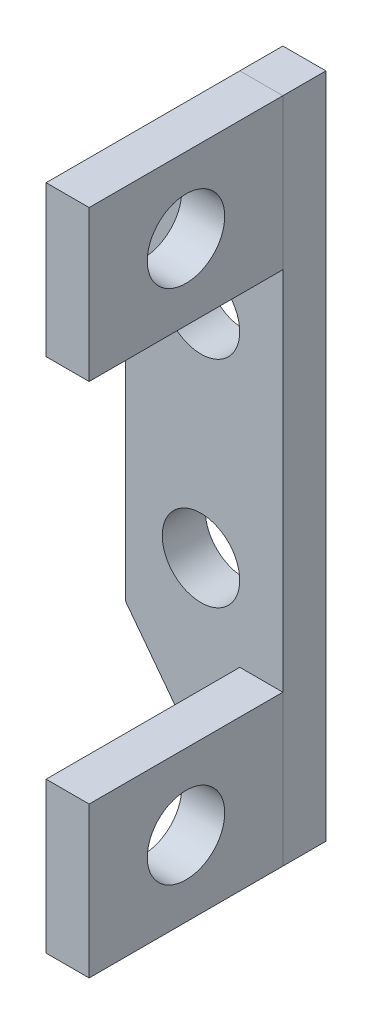
from build123d import *

# Parameters (mm, degrees)
SKETCH2_W                     = 7.304410209
SKETCH2_H                     = 17
BOSS_EXTRUDE1_DEPTH           = 2
M3_CLEARANCE_HOLE1_D          = 3.6
SKETCH6_W                     = 2
SKETCH6_H                     = 7
BOSS_EXTRUDE2_DEPTH           = 9
BOSS_EXTRUDE2_2_DEPTH         = 9
SKETCH8_W                     = 1.8
SKETCH8_H                     = 2
M3_CLEARANCE_HOLE2_AT_2_COUNT = 2
M3_CLEARANCE_HOLE2_AT_2_PITCH = 24


with BuildPart() as part:
    # Sketch2 → Boss-Extrude1 (new body)
    with BuildSketch(Plane.XY):
        Polygon((-4.695589791, 189.920635549), (-10, 196.920635549), (-2.695589791, 196.920635549), (-2.695589791, 189.920635549), align=None)
        Polygon((-2.695589791, 220.920635549), (-4.695589791, 220.920635549), (-10, 213.920635549), (-2.695589791, 213.920635549), align=None)
        with Locations((-6.347794895, 205.420635549)):
            Rectangle(SKETCH2_W, SKETCH2_H)
    extrude(amount=BOSS_EXTRUDE1_DEPTH)

    # M3 Clearance Hole1 (through all)
    with Locations(Plane.XY.offset(2)):
        with Locations((-6.5, 200.420635549), (-6.5, 210.420635549)):
            Hole(M3_CLEARANCE_HOLE1_D / 2)


with BuildPart() as body_2:
    # Sketch6 → Boss-Extrude2 (new body)
    with BuildSketch(Plane.XY.offset(2)):
        with Locations((-3.695589791, 217.420635549)):
            Rectangle(SKETCH6_W, SKETCH6_H)
    extrude(amount=BOSS_EXTRUDE2_DEPTH)


with BuildPart() as body_3:
    # Sketch6 → Boss-Extrude2 2 (new body)
    with BuildSketch(Plane.XY.offset(2)):
        with Locations((-3.695589791, 193.420635549)):
            Rectangle(SKETCH6_W, SKETCH6_H)
    extrude(amount=BOSS_EXTRUDE2_2_DEPTH)

    # Sketch8 → M3 Clearance Hole2 (revolve, cut)
    with BuildSketch(Plane(origin=(-4.695589791, 193.420635549, 6.5), x_dir=(0, 0, 1), z_dir=(0, 1, 0))):
        with Locations((0.9, 1)):
            Rectangle(SKETCH8_W, SKETCH8_H)
    m3_clearance_hole2 = revolve(axis=Axis((-11.045589791, 193.420635549, 6.5), (1, 0, 0)), mode=Mode.SUBTRACT)


with BuildPart() as body_2_1:
    add(body_2.part)

    # M3 Clearance Hole2 at 2: M3 Clearance Hole2 ×2
    with Locations(*[(0, i * M3_CLEARANCE_HOLE2_AT_2_PITCH, 0) for i in range(1, M3_CLEARANCE_HOLE2_AT_2_COUNT)]):
        add(m3_clearance_hole2, mode=Mode.SUBTRACT)


solid = Compound([part.part, body_3.part, body_2_1.part])
